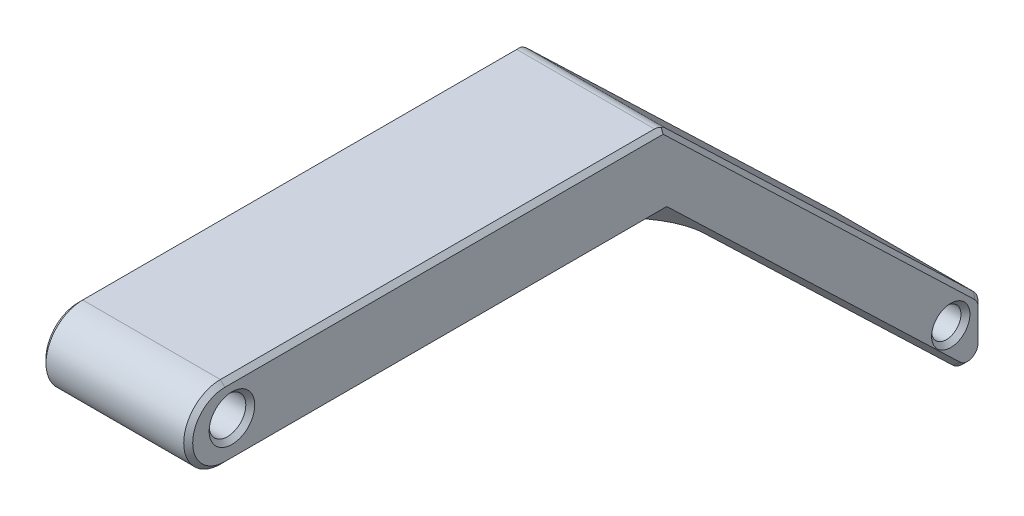
from build123d import *

# Parameters (mm, degrees)
SKETCH_1_W          = 12
SKETCH_1_H          = 2
EXTRUDE_1_DEPTH     = 4
EXTRUDE_2_DEPTH     = 4
EXTRUDE_4_DEPTH     = 4
SKETCH_8_R          = 0.5
CUT_EXTRUDE_1_DEPTH = 10
SKETCH_9_R          = 0.4
CUT_EXTRUDE_2_DEPTH = 10
SCALE_1_SCALE       = 2.454545455
FILLET_1_R          = 1
CHAMFER_1_SIZE      = 0.3
FILLET_2_R          = 1
FILLET_3_R          = 10


with BuildPart() as part:
    # 草图1 → 凸台-拉伸1 (new body)
    with BuildSketch(Plane(origin=(0, 0, 0), x_dir=(0, 0, -1), z_dir=(1, 0, 0))):
        with Locations((-7.174242424, 4.674378087)):
            Rectangle(SKETCH_1_W, SKETCH_1_H)
    extrude(amount=EXTRUDE_1_DEPTH)

    # 草图4 → 凸台-拉伸2 (add)
    with BuildSketch(Plane(origin=(4, 0, 0), x_dir=(0, 0, -1), z_dir=(1, 0, 0))):
        Polygon((-1.174242424, 5.674378087), (-1.174242424, 3.674378087), (7.484707821, -4.633604859), (7.484707821, -2.633604859), align=None)
    extrude(amount=-EXTRUDE_2_DEPTH)

    # 草图7 → 凸台-拉伸4 (add)
    with BuildSketch(Plane(origin=(4, 0, 0), x_dir=(0, 0, -1), z_dir=(1, 0, 0))):
        with BuildLine():
            Line((-13.174242424, 5.674378087), (-13.174242424, 3.674378087))
            ThreePointArc((-13.174242424, 3.674378087), (-14.174242424, 4.674378087), (-13.174242424, 5.674378087))
        make_face()
    extrude(amount=-EXTRUDE_4_DEPTH)

    # 草图8 → 切除-拉伸1 (cut)
    with BuildSketch(Plane(origin=(4, 0, 0), x_dir=(0, 0, -1), z_dir=(1, 0, 0))):
        with Locations((-12.981538842, 4.72790686)):
            Circle(SKETCH_8_R)
    extrude(amount=-CUT_EXTRUDE_1_DEPTH, mode=Mode.SUBTRACT)

    # 草图9 → 切除-拉伸2 (cut)
    with BuildSketch(Plane(origin=(4, 0, 0), x_dir=(0, 0, -1), z_dir=(1, 0, 0))):
        with Locations((6.619490877, -2.882976322)):
            Circle(SKETCH_9_R)
    extrude(amount=-CUT_EXTRUDE_2_DEPTH, mode=Mode.SUBTRACT)


with BuildPart() as part_1:
    # 缩放比例1: scaled about (2, 3.035419998, 3.173801188)
    add(part.part.scale(SCALE_1_SCALE).moved(Location((-2.909090909, -4.415156361, -4.616438092))))

    # 圆角1
    fillet_1_edges = [part_1.edges().sort_by_distance(p)[0] for p in [
        (2, -10.879459197, -22.987993653),
        (2, -15.788550106, -22.987993653),
    ]]
    fillet(fillet_1_edges, radius=FILLET_1_R)

    # 倒角1
    chamfer_1_edges = [part_1.edges().sort_by_distance(p)[0] for p in [
        (-2.909090909, -4.780520326, -11.514934214),
        (6.909090909, 4.603771672, 12.993066041),
        (6.909090909, -4.780520326, -11.514934214),
        (-2.909090909, 7.058317127, 30.174884222),
        (6.909090909, 7.058317127, 30.174884222),
        (6.909090909, 7.189705933, 28.474611794),
        (6.909090909, -11.491552788, -19.882461153),
        (6.909090909, -12.374536967, -22.987993653),
        (-2.909090909, -12.374536967, -22.987993653),
        (-2.909090909, 4.603771672, 12.993066041),
        (6.909090909, -0.535699514, -12.207266126),
        (6.909090909, -14.36310593, -22.380210486),
        (6.909090909, -10.913623963, -22.907866447),
        (-2.909090909, -0.535699514, -12.207266126),
        (-2.909090909, -14.36310593, -22.380210486),
        (-2.909090909, -10.913623963, -22.907866447),
        (-2.909090909, 9.512862581, 12.993066041),
        (6.909090909, 9.512862581, 12.993066041),
    ]]
    chamfer(chamfer_1_edges, length=CHAMFER_1_SIZE)

    # 圆角2
    fillet_2_edges = [part_1.edges().sort_by_distance(p)[0] for p in [
        (2, 9.512862581, -1.734206687),
    ]]
    fillet(fillet_2_edges, radius=FILLET_2_R)

    # 圆角3
    fillet_3_edges = [part_1.edges().sort_by_distance(p)[0] for p in [
        (2, 4.603771672, -1.734206687),
    ]]
    fillet(fillet_3_edges, radius=FILLET_3_R)


solid = part_1.part
